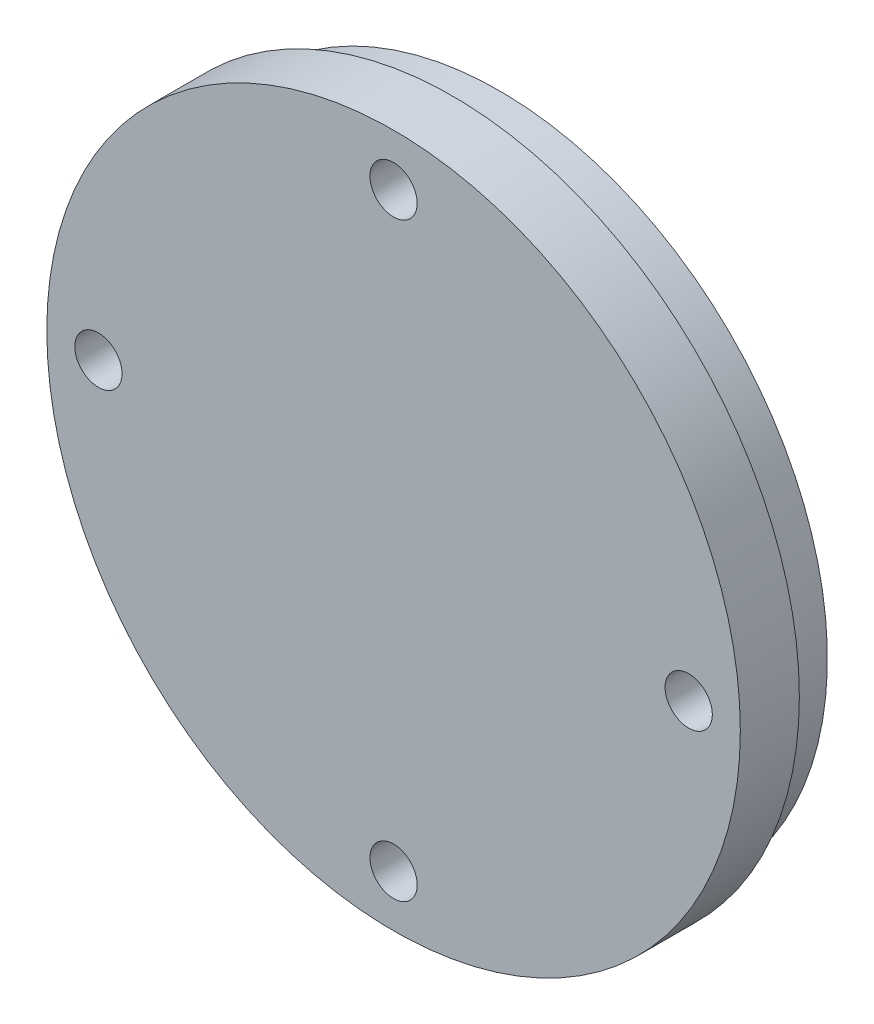
from build123d import *

# Parameters (mm, degrees)
SKETCH_1_R          = 23.5
EXTRUDE_1_DEPTH     = 4
SKETCH_2_R          = 22.225
EXTRUDE_2_DEPTH     = 3.175
SKETCH_3_R          = 1.6
CUT_EXTRUDE_1_DEPTH = 34.999715072


with BuildPart() as part:
    # ｽｹｯﾁ1 → ﾎﾞｽ - 押し出し1 (new body)
    with BuildSketch(Plane.XY):
        Circle(SKETCH_1_R)
    extrude(amount=EXTRUDE_1_DEPTH)

    # ｽｹｯﾁ2 → ﾎﾞｽ - 押し出し2 (add)
    with BuildSketch(Plane(origin=(0, 0, 0), x_dir=(-1, 0, 0), z_dir=(0, 0, -1))):
        Circle(SKETCH_2_R)
    extrude(amount=EXTRUDE_2_DEPTH)

    # ｽｹｯﾁ3 → ｶｯﾄ - 押し出し1 (cut, through all)
    with BuildSketch(Plane(origin=(0, 0, -3.175), x_dir=(-1, 0, 0), z_dir=(0, 0, -1))):
        with Locations((0, 20)):
            Circle(SKETCH_3_R)
        with Locations((20, 0)):
            Circle(SKETCH_3_R)
        with Locations((0, -20)):
            Circle(SKETCH_3_R)
        with Locations((-20, 0)):
            Circle(SKETCH_3_R)
    extrude(amount=-CUT_EXTRUDE_1_DEPTH, mode=Mode.SUBTRACT)


solid = part.part
